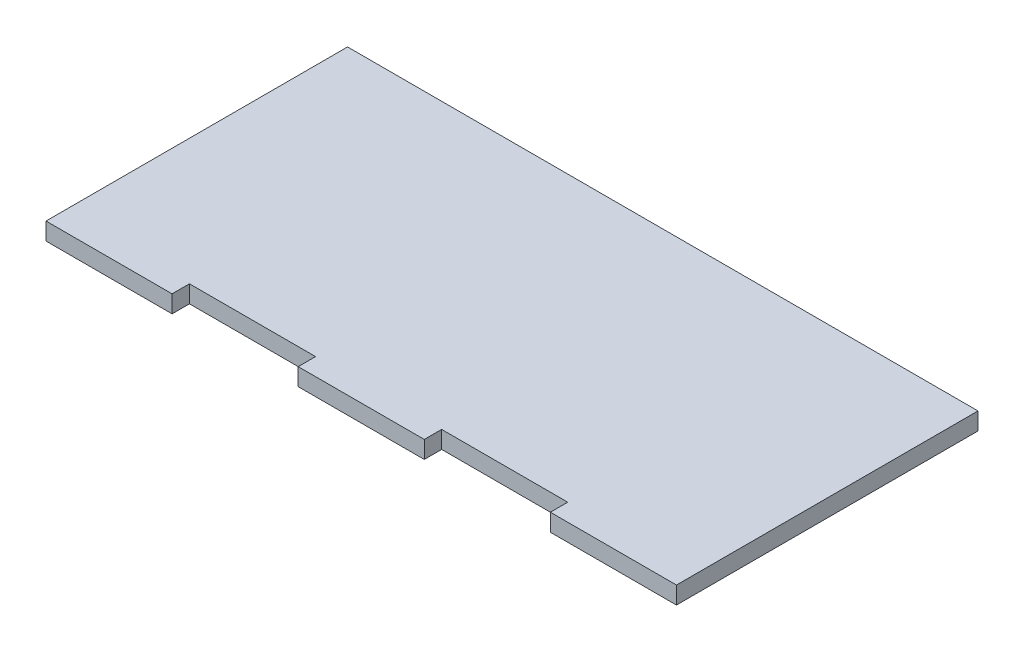
from build123d import *

# Parameters (mm, degrees)
SKETCH1_W           = 354.00488
SKETCH1_H           = 169.3164
BOSS_EXTRUDE1_DEPTH = 9.7536
SKETCH2_W           = 70.800976
SKETCH2_H           = 9.7536
CUT_EXTRUDE1_DEPTH  = 333.802189186


with BuildPart() as part:
    # Sketch1 → Boss-Extrude1 (new body)
    with BuildSketch(Plane(origin=(0, 0, 0), x_dir=(1, 0, 0), z_dir=(0, 1, 0))):
        with Locations((107.281446772, 88.098380587)):
            Rectangle(SKETCH1_W, SKETCH1_H)
    extrude(amount=BOSS_EXTRUDE1_DEPTH)

    # Sketch2 → Cut-Extrude1 (cut, through all)
    with BuildSketch(Plane.XZ):
        with Locations((178.082422772, -8.316980587)):
            Rectangle(SKETCH2_W, SKETCH2_H)
        with Locations((36.480470772, -8.316980587)):
            Rectangle(SKETCH2_W, SKETCH2_H)
    extrude(amount=-CUT_EXTRUDE1_DEPTH, mode=Mode.SUBTRACT)


solid = part.part
